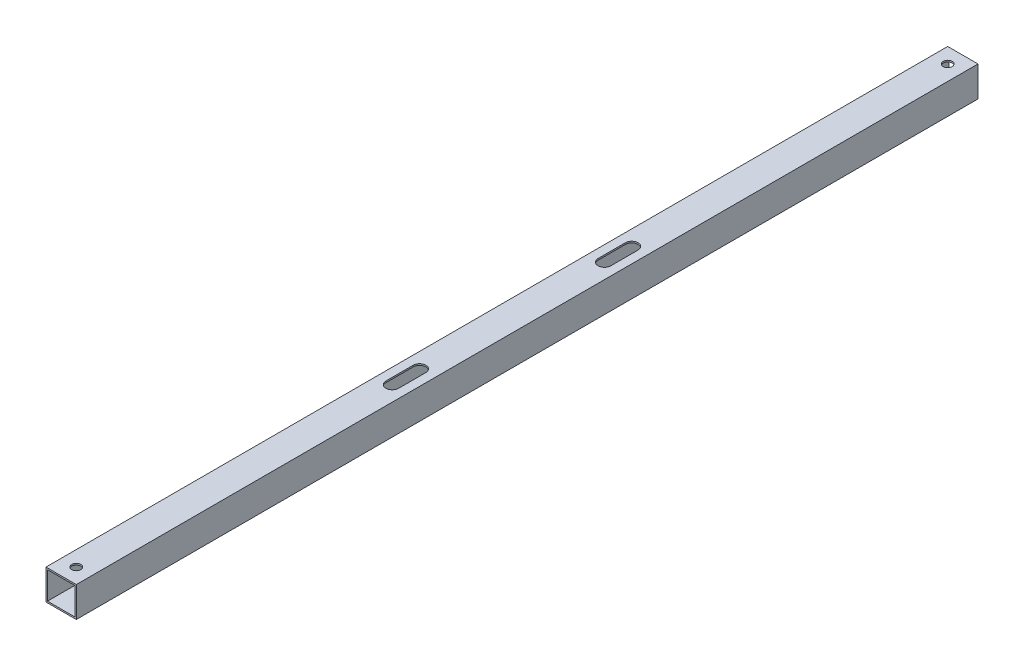
from build123d import *

# Parameters (mm, degrees)
SKETCH_1_W          = 20
SKETCH_1_H          = 20
SKETCH_1_W_2        = 18
SKETCH_1_H_2        = 18
EXTRUDE_1_DEPTH     = 297.5
SKETCH_2_R          = 3
CUT_EXTRUDE_1_DEPTH = 10
SKETCH_4_R          = 2
CUT_EXTRUDE_3_DEPTH = 10
CUT_EXTRUDE_4_DEPTH = 10


with BuildPart() as part:
    # 草图1 → 凸台-拉伸1 (new, symmetric)
    with BuildSketch(Plane.XY):
        Rectangle(SKETCH_1_W, SKETCH_1_H)
        Rectangle(SKETCH_1_W_2, SKETCH_1_H_2, mode=Mode.SUBTRACT)
    extrude(amount=EXTRUDE_1_DEPTH, both=True)

    # 草图2 → 切除-拉伸1 (cut)
    with BuildSketch(Plane(origin=(0, 10, 0), x_dir=(1, 0, 0), z_dir=(0, 1, 0))):
        with Locations(Location((0, -287.5, 0), (0, 0, 270))):
            Circle(SKETCH_2_R)
    cut_extrude_1 = extrude(amount=-CUT_EXTRUDE_1_DEPTH, mode=Mode.SUBTRACT)

    # 镜向1: 切除-拉伸1 across plane
    add(cut_extrude_1.mirror(Plane.XY), mode=Mode.SUBTRACT)

    # 草图4 → 切除-拉伸3 (cut)
    with BuildSketch(Plane(origin=(0, -9, 0), x_dir=(1, 0, 0), z_dir=(0, 1, 0))):
        with Locations(Location((0, -79, 0), (0, 0, 270))):
            Circle(SKETCH_4_R)
        with Locations(Location((0, -61, 0), (0, 0, 270))):
            Circle(SKETCH_4_R)
    cut_extrude_3 = extrude(amount=-CUT_EXTRUDE_3_DEPTH, mode=Mode.SUBTRACT)

    # 草图5 → 切除-拉伸4 (cut)
    with BuildSketch(Plane.XZ.offset(-9)):
        with BuildLine():
            Line((4.2, 79), (4.2, 61))
            ThreePointArc((4.2, 61), (0, 56.8), (-4.2, 61))
            Line((-4.2, 61), (-4.2, 79))
            ThreePointArc((-4.2, 79), (0, 83.2), (4.2, 79))
        make_face()
    cut_extrude_4 = extrude(amount=-CUT_EXTRUDE_4_DEPTH, mode=Mode.SUBTRACT)

    # 镜向2: 切除-拉伸3, 切除-拉伸4 across plane
    add(cut_extrude_3.mirror(Plane.XY), mode=Mode.SUBTRACT)
    add(cut_extrude_4.mirror(Plane.XY), mode=Mode.SUBTRACT)


solid = part.part
